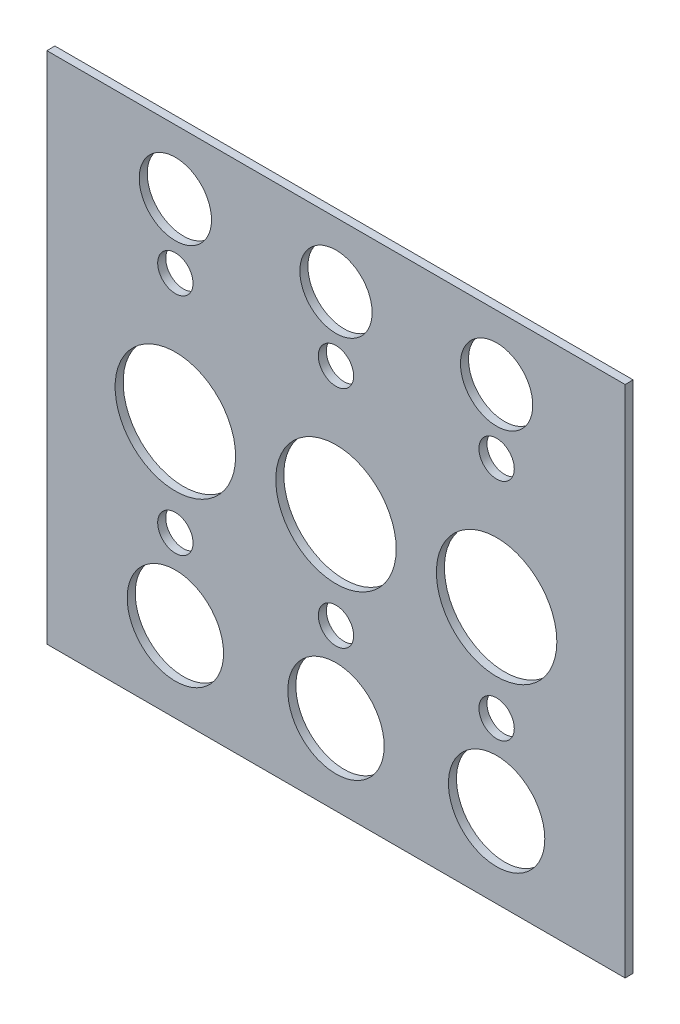
from build123d import *

# Parameters (mm, degrees)
ESBO_O1_W                = 360
ESBO_O1_H                = 320
ESBO_O1_R                = 11
ESBO_O1_R_2              = 37.5
ESBO_O1_R_3              = 30
ESBO_O1_R_4              = 22.5
RESSALTO_EXTRUS_O1_DEPTH = 5


with BuildPart() as part:
    # Esboço1 → Ressalto-extrusão1 (new body)
    with BuildSketch(Plane.XY):
        Rectangle(ESBO_O1_W, ESBO_O1_H)
        with Locations((0, 80)):
            Circle(ESBO_O1_R, mode=Mode.SUBTRACT)
        with Locations((-100, 80)):
            Circle(ESBO_O1_R, mode=Mode.SUBTRACT)
        with Locations((100, 80)):
            Circle(ESBO_O1_R, mode=Mode.SUBTRACT)
        with Locations((0, -60)):
            Circle(ESBO_O1_R, mode=Mode.SUBTRACT)
        with Locations((100, -60)):
            Circle(ESBO_O1_R, mode=Mode.SUBTRACT)
        with Locations((-100, -60)):
            Circle(ESBO_O1_R, mode=Mode.SUBTRACT)
        with Locations((-100, 0)):
            Circle(ESBO_O1_R_2, mode=Mode.SUBTRACT)
        Circle(ESBO_O1_R_2, mode=Mode.SUBTRACT)
        with Locations((100, 0)):
            Circle(ESBO_O1_R_2, mode=Mode.SUBTRACT)
        with Locations((100, -110)):
            Circle(ESBO_O1_R_3, mode=Mode.SUBTRACT)
        with Locations((0, -110)):
            Circle(ESBO_O1_R_3, mode=Mode.SUBTRACT)
        with Locations((-100, -110)):
            Circle(ESBO_O1_R_3, mode=Mode.SUBTRACT)
        with Locations((-100, 120)):
            Circle(ESBO_O1_R_4, mode=Mode.SUBTRACT)
        with Locations((0, 120)):
            Circle(ESBO_O1_R_4, mode=Mode.SUBTRACT)
        with Locations((100, 120)):
            Circle(ESBO_O1_R_4, mode=Mode.SUBTRACT)
    extrude(amount=RESSALTO_EXTRUS_O1_DEPTH)


solid = part.part
